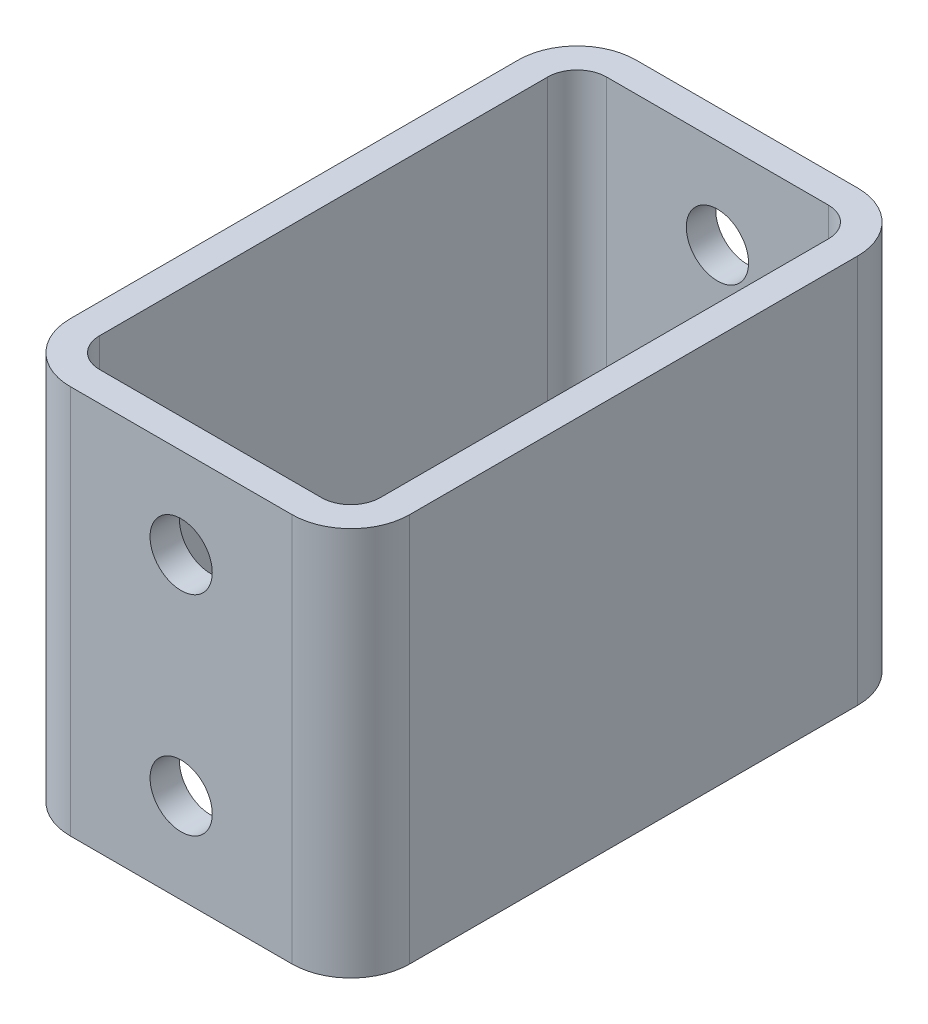
from build123d import *

# Parameters (mm, degrees)
RECTANGULAR_TUBE_CONFIGURED_50_X_30_X_DEPTH = 34.4
M5_CLEARANCE_HOLE1_D                        = 5.5


with BuildPart() as part:
    # Sketch13 → Rectangular tube - configured 50 X 30 X 2.6(1) (new body)
    with BuildSketch(Plane(origin=(0, 0, 0), x_dir=(1, 0, 0), z_dir=(0, 1, 0))):
        with BuildLine():
            Line((-9.8, -25), (9.8, -25))
            ThreePointArc((9.8, -25), (13.476955262, -23.476955262), (15, -19.8))
            Line((15, -19.8), (15, 19.8))
            ThreePointArc((15, 19.8), (13.476955262, 23.476955262), (9.8, 25))
            Line((9.8, 25), (-9.8, 25))
            ThreePointArc((-9.8, 25), (-13.476955262, 23.476955262), (-15, 19.8))
            Line((-15, 19.8), (-15, -19.8))
            ThreePointArc((-15, -19.8), (-13.476955262, -23.476955262), (-9.8, -25))
        make_face()
        with BuildLine():
            Line((-9.8, -22.4), (9.8, -22.4))
            ThreePointArc((9.8, -22.4), (11.638477631, -21.638477631), (12.4, -19.8))
            Line((12.4, -19.8), (12.4, 19.8))
            ThreePointArc((12.4, 19.8), (11.638477631, 21.638477631), (9.8, 22.4))
            Line((9.8, 22.4), (-9.8, 22.4))
            ThreePointArc((-9.8, 22.4), (-11.638477631, 21.638477631), (-12.4, 19.8))
            Line((-12.4, 19.8), (-12.4, -19.8))
            ThreePointArc((-12.4, -19.8), (-11.638477631, -21.638477631), (-9.8, -22.4))
        make_face(mode=Mode.SUBTRACT)
    extrude(amount=RECTANGULAR_TUBE_CONFIGURED_50_X_30_X_DEPTH)

    # M5 Clearance Hole1 (through all)
    with Locations(Plane(origin=(0, 26.435, 25), x_dir=(1, 0, 0), z_dir=(0, 0, 1))):
        with Locations((0, 0), (0, -18.47)):
            Hole(M5_CLEARANCE_HOLE1_D / 2)


solid = part.part
